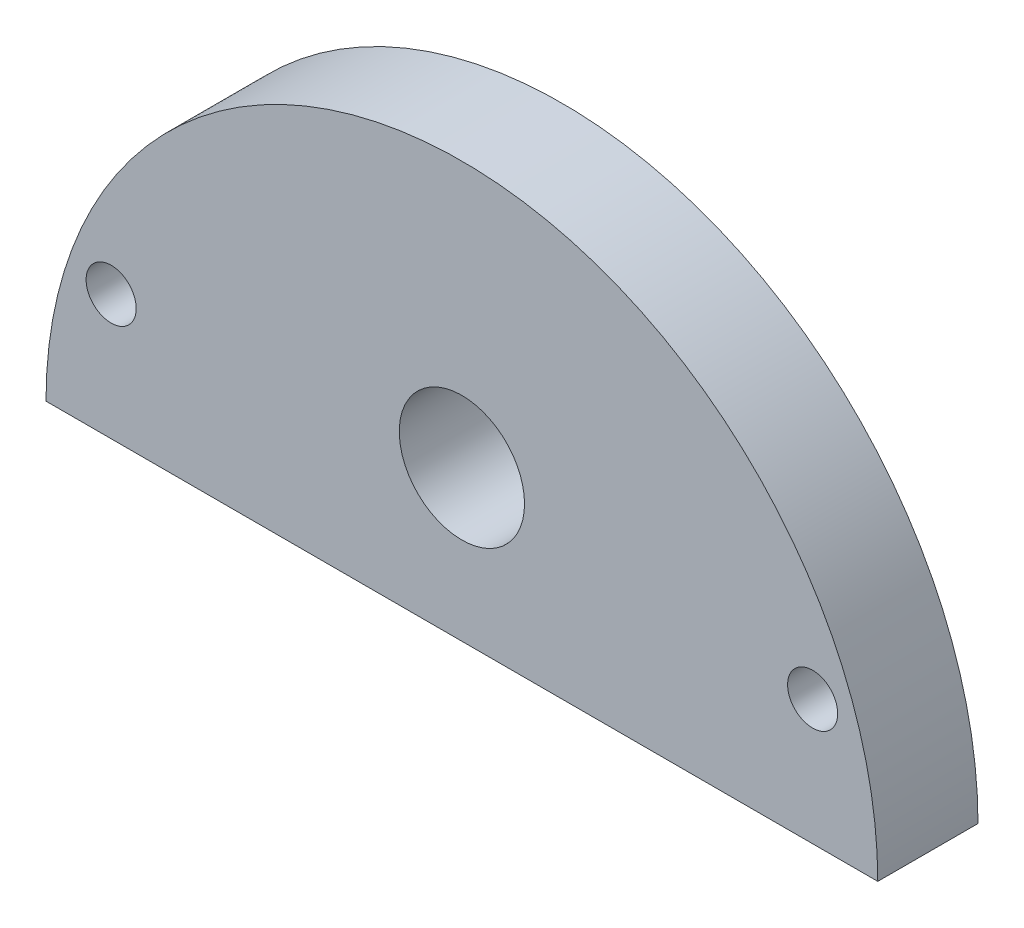
from build123d import *

# Parameters (mm, degrees)
SKETCH_1_R          = 5
EXTRUDE_1_DEPTH     = 8
SKETCH_2_R          = 2
CUT_EXTRUDE_1_DEPTH = 8


with BuildPart() as part:
    # 草图1 → 凸台-拉伸1 (new body)
    with BuildSketch(Plane.XY):
        with BuildLine():
            Line((-33.201361832, 0), (33.201361832, 0))
            ThreePointArc((33.201361832, 0), (0, 33.201361832), (-33.201361832, 0))
        make_face()
        with Locations((0, 12)):
            Circle(SKETCH_1_R, mode=Mode.SUBTRACT)
    extrude(amount=EXTRUDE_1_DEPTH)

    # 草图2 → 切除-拉伸1 (cut)
    with BuildSketch(Plane.XY.offset(8)):
        with Locations((-28, 10)):
            Circle(SKETCH_2_R)
        with Locations((28, 10)):
            Circle(SKETCH_2_R)
    extrude(amount=-CUT_EXTRUDE_1_DEPTH, mode=Mode.SUBTRACT)


solid = part.part
